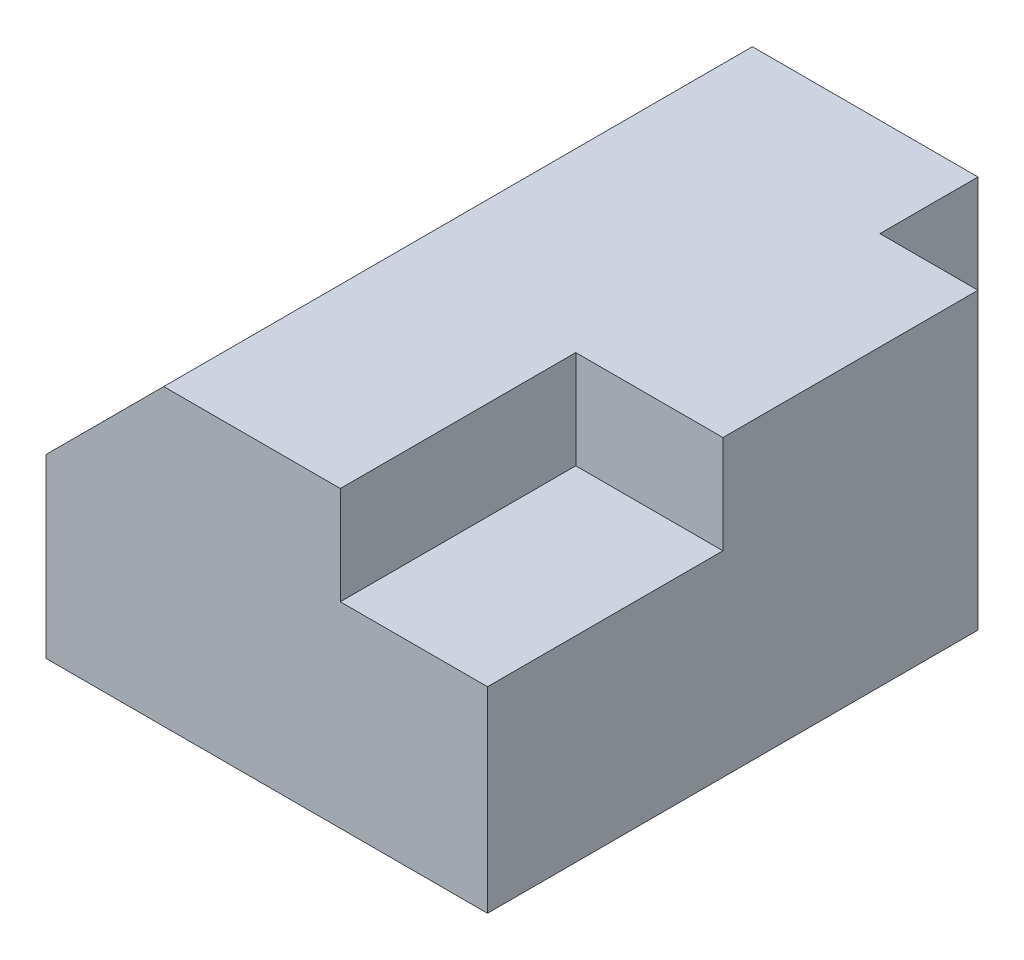
from build123d import *

# Parameters (mm, degrees)
BOSS_EXTRUDE1_DEPTH = 60
SKETCH3_W           = 15
SKETCH3_H           = 36
BOSS_EXTRUDE2_DEPTH = 10
SKETCH4_W           = 10
SKETCH4_H           = 10
CUT_EXTRUDE2_DEPTH  = 40


with BuildPart() as part:
    # Sketch1 → Boss-Extrude1 (new body)
    with BuildSketch(Plane.XY):
        Polygon((-22.044198895, 13.662983425), (-22.044198895, -4.337016575), (22.955801105, -4.337016575), (22.955801105, 15.662983425), (7.955801105, 15.662983425), (7.955801105, 25.662983425), (-10.044198895, 25.662983425), align=None)
    extrude(amount=BOSS_EXTRUDE1_DEPTH)

    # Sketch3 → Boss-Extrude2 (add)
    with BuildSketch(Plane(origin=(0, 15.662983425, 0), x_dir=(1, 0, 0), z_dir=(0, 1, 0))):
        with Locations((15.455801105, -18)):
            Rectangle(SKETCH3_W, SKETCH3_H)
    extrude(amount=BOSS_EXTRUDE2_DEPTH)

    # Sketch4 → Cut-Extrude2 (cut)
    with BuildSketch(Plane(origin=(0, 25.662983425, 0), x_dir=(1, 0, 0), z_dir=(0, 1, 0))):
        with Locations((17.955801105, -5)):
            Rectangle(SKETCH4_W, SKETCH4_H)
    extrude(amount=-CUT_EXTRUDE2_DEPTH, mode=Mode.SUBTRACT)


solid = part.part
